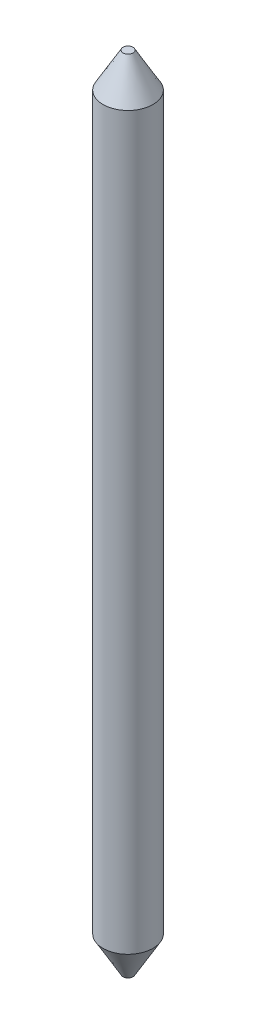
from build123d import *

# Parameters (mm, degrees)
SKETCH1_R           = 3.175
BOSS_EXTRUDE1_DEPTH = 101.6


with BuildPart() as part:
    # Sketch1 → Boss-Extrude1 (new body)
    with BuildSketch(Plane(origin=(0, 0, 0), x_dir=(1, 0, 0), z_dir=(0, 1, 0))):
        with Locations(Location((0, 0, 0), (0, 0, 270))):
            Circle(SKETCH1_R)
    extrude(amount=BOSS_EXTRUDE1_DEPTH)

    # Sketch3 → Cut-Revolve2 (revolve, cut)
    with BuildSketch(Plane.XY, mode=Mode.PRIVATE) as cut_revolve2_sk:
        Polygon((3.175, 97.200590949), (0.635, 101.6), (3.175, 101.6), align=None)
    cut_revolve2 = revolve(cut_revolve2_sk.sketch.rotate(Axis((0, 101.6, 0), (0, -1, 0)), 270), axis=Axis((0, 101.6, 0), (0, -1, 0)), mode=Mode.SUBTRACT)

    # Mirror1: Cut-Revolve2 across plane
    add(cut_revolve2.mirror(Plane.ZX.offset(50.8)), mode=Mode.SUBTRACT)


solid = part.part
